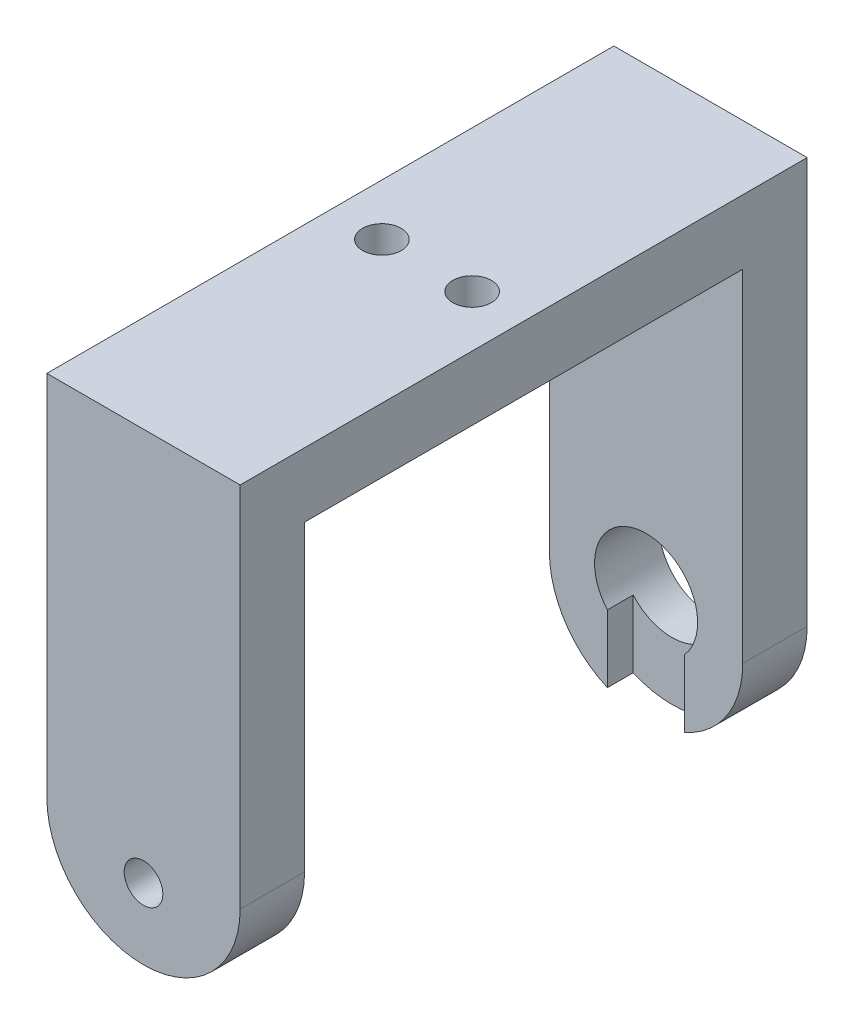
from build123d import *

# Parameters (mm, degrees)
CROQUIS1_W              = 15
CROQUIS1_H              = 44
CROQUIS1_R              = 1.5
SALIENTE_EXTRUIR1_DEPTH = 5
CROQUIS2_W              = 15
CROQUIS2_H              = 5
SALIENTE_EXTRUIR2_DEPTH = 34
CROQUIS2_3_W            = 15
CROQUIS2_3_H            = 5
SALIENTE_EXTRUIR3_DEPTH = 31
CORTAR_EXTRUIR1_REACH   = 61.273
CROQUIS3_R              = 1.5
CORTAR_EXTRUIR2_REACH   = 61.273
CROQUIS4_R              = 4
CROQUIS5_W              = 6
CROQUIS5_H              = 5.854248689
CORTAR_EXTRUIR3_DEPTH   = 2
CORTAR_EXTRUIR4_DEPTH   = 3


with BuildPart() as part:
    # Croquis1 → Saliente-Extruir1 (new body)
    with BuildSketch(Plane(origin=(0, 0, 0), x_dir=(1, 0, 0), z_dir=(0, 1, 0))):
        Rectangle(CROQUIS1_W, CROQUIS1_H)
        with Locations((3.5, 0)):
            Circle(CROQUIS1_R, mode=Mode.SUBTRACT)
        with Locations((-3.5, 0)):
            Circle(CROQUIS1_R, mode=Mode.SUBTRACT)
    extrude(amount=-SALIENTE_EXTRUIR1_DEPTH)

    # Croquis2 → Saliente-Extruir2 (add)
    with BuildSketch(Plane.XZ.offset(5)):
        with Locations((0, -19.5)):
            Rectangle(CROQUIS2_W, CROQUIS2_H)
    extrude(amount=SALIENTE_EXTRUIR2_DEPTH)

    # Croquis2<3> → Saliente-Extruir3 (add)
    with BuildSketch(Plane.XZ.offset(5)):
        with Locations((0, 19.5)):
            Rectangle(CROQUIS2_3_W, CROQUIS2_3_H)
    extrude(amount=SALIENTE_EXTRUIR3_DEPTH)

    # Croquis3 → Cortar-Extruir1 (cut, up to next)
    with BuildSketch(Plane.XY.offset(22), mode=Mode.PRIVATE) as cortar_extruir1_sk1:
        with BuildLine():
            ThreePointArc((0, -36), (-5.303300859, -33.803300859), (-7.5, -28.5))
            Line((-7.5, -28.5), (-7.5, -36))
            Line((-7.5, -36), (0, -36))
        make_face()
    cortar_extruir1_tool1 = extrude(cortar_extruir1_sk1.sketch, amount=-CORTAR_EXTRUIR1_REACH, mode=Mode.PRIVATE) & part.part
    # Croquis3 → Cortar-Extruir1 (cut, up to next)
    with BuildSketch(Plane.XY.offset(22), mode=Mode.PRIVATE) as cortar_extruir1_sk2:
        with BuildLine():
            Line((7.5, -36), (7.5, -28.5))
            ThreePointArc((7.5, -28.5), (5.303300859, -33.803300859), (0, -36))
            Line((0, -36), (7.5, -36))
        make_face()
    cortar_extruir1_tool2 = extrude(cortar_extruir1_sk2.sketch, amount=-CORTAR_EXTRUIR1_REACH, mode=Mode.PRIVATE) & part.part
    # Croquis3 → Cortar-Extruir1 (cut, up to next)
    with BuildSketch(Plane.XY.offset(22), mode=Mode.PRIVATE) as cortar_extruir1_sk3:
        with Locations((0, -30.5)):
            Circle(CROQUIS3_R)
    cortar_extruir1_tool3 = extrude(cortar_extruir1_sk3.sketch, amount=-CORTAR_EXTRUIR1_REACH, mode=Mode.PRIVATE) & part.part
    add(cortar_extruir1_tool1.solids().sort_by_distance((-5.82474, -34.32474, 22))[0], mode=Mode.SUBTRACT)
    add(cortar_extruir1_tool2.solids().sort_by_distance((5.82474, -34.32474, 22))[0], mode=Mode.SUBTRACT)
    add(cortar_extruir1_tool3.solids().sort_by_distance((0, -30.5, 22))[0], mode=Mode.SUBTRACT)

    # Croquis4 → Cortar-Extruir2 (cut, up to next)
    with BuildSketch(Plane(origin=(0, 0, -22), x_dir=(-1, 0, 0), z_dir=(0, 0, -1)), mode=Mode.PRIVATE) as cortar_extruir2_sk1:
        with Locations((0, -30.5)):
            Circle(CROQUIS4_R)
    cortar_extruir2_tool1 = extrude(cortar_extruir2_sk1.sketch, amount=-CORTAR_EXTRUIR2_REACH, mode=Mode.PRIVATE) & part.part
    # Croquis4 → Cortar-Extruir2 (cut, up to next)
    with BuildSketch(Plane(origin=(0, 0, -22), x_dir=(-1, 0, 0), z_dir=(0, 0, -1)), mode=Mode.PRIVATE) as cortar_extruir2_sk2:
        with BuildLine():
            Line((7.5, -39), (7.5, -31.5))
            ThreePointArc((7.5, -31.5), (5.303300859, -36.803300859), (0, -39))
            Line((0, -39), (7.5, -39))
        make_face()
    cortar_extruir2_tool2 = extrude(cortar_extruir2_sk2.sketch, amount=-CORTAR_EXTRUIR2_REACH, mode=Mode.PRIVATE) & part.part
    # Croquis4 → Cortar-Extruir2 (cut, up to next)
    with BuildSketch(Plane(origin=(0, 0, -22), x_dir=(-1, 0, 0), z_dir=(0, 0, -1)), mode=Mode.PRIVATE) as cortar_extruir2_sk3:
        with BuildLine():
            ThreePointArc((0, -39), (-5.303300862, -36.803300856), (-7.5, -31.499999991))
            Line((-7.5, -31.499999991), (-7.5, -39))
            Line((-7.5, -39), (0, -39))
        make_face()
    cortar_extruir2_tool3 = extrude(cortar_extruir2_sk3.sketch, amount=-CORTAR_EXTRUIR2_REACH, mode=Mode.PRIVATE) & part.part
    add(cortar_extruir2_tool1.solids().sort_by_distance((0, -30.5, -22))[0], mode=Mode.SUBTRACT)
    add(cortar_extruir2_tool2.solids().sort_by_distance((-5.82474, -37.32474, -22))[0], mode=Mode.SUBTRACT)
    add(cortar_extruir2_tool3.solids().sort_by_distance((5.82474, -37.32474, -22))[0], mode=Mode.SUBTRACT)

    # Croquis5 → Cortar-Extruir3 (cut)
    with BuildSketch(Plane.XY.offset(-17)):
        with Locations((0, -36.072875655)):
            Rectangle(CROQUIS5_W, CROQUIS5_H)
    extrude(amount=-CORTAR_EXTRUIR3_DEPTH, mode=Mode.SUBTRACT)

    # Croquis6 → Cortar-Extruir4 (cut)
    with BuildSketch(Plane(origin=(0, 0, -22), x_dir=(-1, 0, 0), z_dir=(0, 0, -1))):
        with BuildLine():
            Line((2.125, -10.5), (-2.125, -10.5))
            Line((-2.125, -10.5), (-3.464101615, -28.5))
            ThreePointArc((-3.464101615, -28.5), (0, -26.5), (3.464101615, -28.5))
            Line((3.464101615, -28.5), (2.125, -10.5))
        make_face()
    extrude(amount=-CORTAR_EXTRUIR4_DEPTH, mode=Mode.SUBTRACT)


solid = part.part
